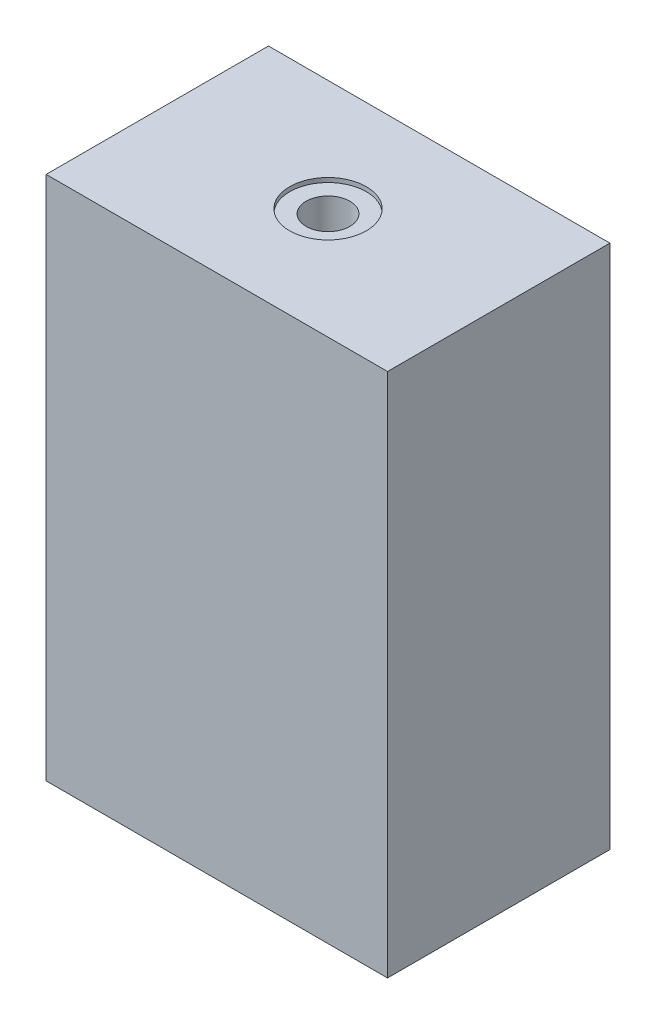
from build123d import *

# Parameters (mm, degrees)
SKETCH_1_W          = 7.8
SKETCH_1_H          = 5.08
EXTRUDE_1_DEPTH     = 12
SKETCH_2_R          = 0.5
CUT_EXTRUDE_1_DEPTH = 12
SKETCH_3_R          = 0.875
CUT_EXTRUDE_2_DEPTH = 0.1
CUT_EXTRUDE_START   = -10
SKETCH_4_W          = 1.5
SKETCH_4_H          = 2
CUT_EXTRUDE_3_DEPTH = 10


with BuildPart() as part:
    # 草图1 → 拉伸1 (new body)
    with BuildSketch(Plane(origin=(0, 0, 0), x_dir=(1, 0, 0), z_dir=(0, 1, 0))):
        Rectangle(SKETCH_1_W, SKETCH_1_H)
    extrude(amount=EXTRUDE_1_DEPTH)

    # 草图2 → 切除-拉伸1 (cut)
    with BuildSketch(Plane(origin=(0, 12, 0), x_dir=(1, 0, 0), z_dir=(0, 1, 0))):
        with Locations(Location((0, 0, 0), (0, 0, 270))):
            Circle(SKETCH_2_R)
    extrude(amount=-CUT_EXTRUDE_1_DEPTH, mode=Mode.SUBTRACT)

    # 草图3 → 切除-拉伸2 (cut)
    with BuildSketch(Plane(origin=(0, 12, 0), x_dir=(1, 0, 0), z_dir=(0, 1, 0))):
        with Locations(Location((0, 0, 0), (0, 0, 270))):
            Circle(SKETCH_3_R)
    extrude(amount=-CUT_EXTRUDE_2_DEPTH, mode=Mode.SUBTRACT)

    # 草图4 → 切除-拉伸3 (cut)
    with BuildSketch(Plane.XZ.offset(CUT_EXTRUDE_START)):
        with Locations((-2.65, 0)):
            Rectangle(SKETCH_4_W, SKETCH_4_H)
        with Locations((2.65, 0)):
            Rectangle(SKETCH_4_W, SKETCH_4_H)
    extrude(amount=CUT_EXTRUDE_3_DEPTH, mode=Mode.SUBTRACT)


solid = part.part
